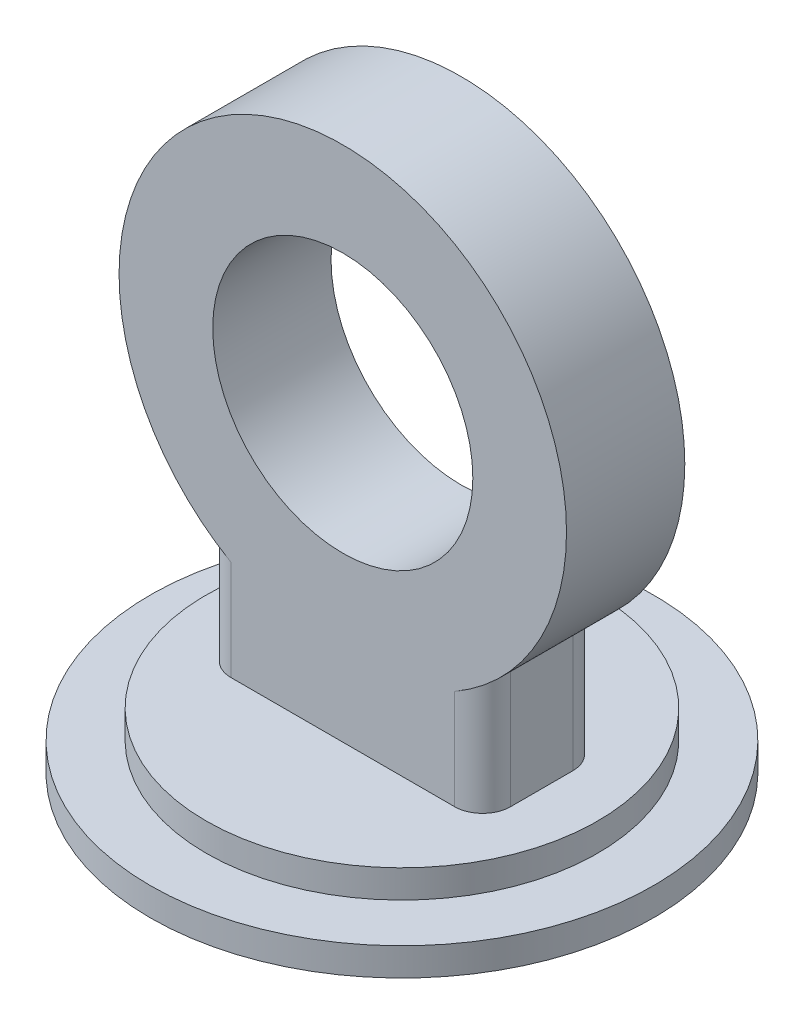
from build123d import *

# Parameters (mm, degrees)
SKETCH_1_R           = 90
EXTRUDE_1_DEPTH      = 10
SKETCH_2_R           = 70
EXTRUDE_2_DEPTH      = 10
SKETCH_4_R           = 80
SKETCH_4_R_2         = 46.5
EXTRUDE_3_DEPTH      = 21.15
EXTRUDE_4_REACH      = 226.555
EXTRUDE_4_END_RADIUS = 80
SKETCH_5_W           = 100
SKETCH_5_H           = 42.3
FILLET_1_R           = 10
SKETCH_6_R           = 46.5
CUT_EXTRUDE_1_DEPTH  = 1


with BuildPart() as part:
    # 草图1 → 凸台-拉伸1 (new body)
    with BuildSketch(Plane(origin=(0, 0, 0), x_dir=(1, 0, 0), z_dir=(0, 1, 0))):
        with Locations(Location((0, 0, 0), (0, 0, 270))):
            Circle(SKETCH_1_R)
    extrude(amount=EXTRUDE_1_DEPTH)

    # 草图2 → 凸台-拉伸2 (add)
    with BuildSketch(Plane(origin=(0, 10, 0), x_dir=(1, 0, 0), z_dir=(0, 1, 0))):
        with Locations(Location((0, 0, 0), (0, 0, 270))):
            Circle(SKETCH_2_R)
    extrude(amount=EXTRUDE_2_DEPTH)



with BuildPart() as body_2:
    # 草图4 → 凸台-拉伸3 (new, symmetric)
    with BuildSketch(Plane.XY):
        with Locations((0, 125)):
            Circle(SKETCH_4_R)
        with Locations((0, 125)):
            Circle(SKETCH_4_R_2, mode=Mode.SUBTRACT)
    extrude(amount=EXTRUDE_3_DEPTH, both=True)


with BuildPart() as part_1:
    add(part.part)

    add(body_2.part)  # 凸台-拉伸4 merges body 2
    # 凸台-拉伸4: up to this cylinder (the profile starts outside it)
    extrude_4_end = Plane(origin=(0, 125, 0), z_dir=(0, 0, -1)) * Cylinder(EXTRUDE_4_END_RADIUS, 614.11, mode=Mode.PRIVATE)
    # 草图5 → 凸台-拉伸4 (add, up to the surface)
    with BuildSketch(Plane(origin=(0, 20, 0), x_dir=(1, 0, 0), z_dir=(0, 1, 0)), mode=Mode.PRIVATE) as extrude_4_sk1:
        Rectangle(SKETCH_5_W, SKETCH_5_H)
    extrude_4_tool1 = extrude(extrude_4_sk1.sketch, amount=EXTRUDE_4_REACH, mode=Mode.PRIVATE) - extrude_4_end
    add(extrude_4_tool1.solids().sort_by_distance((0, 20, 0))[0])

    # 圆角1
    fillet_1_edges = [part_1.edges().sort_by_distance(p)[0] for p in [
        (50, 41.275010008, -21.15),
        (50, 41.275010008, 21.15),
        (-50, 41.275010008, -21.15),
        (-50, 41.275010008, 21.15),
    ]]
    fillet(fillet_1_edges, radius=FILLET_1_R)

    # 草图6 → 切除-拉伸1 (cut)
    with BuildSketch(Plane.XZ):
        with Locations(Location((0, 0, 0), (0, 0, 270))):
            Circle(SKETCH_6_R)
    extrude(amount=-CUT_EXTRUDE_1_DEPTH, mode=Mode.SUBTRACT)


solid = part_1.part
